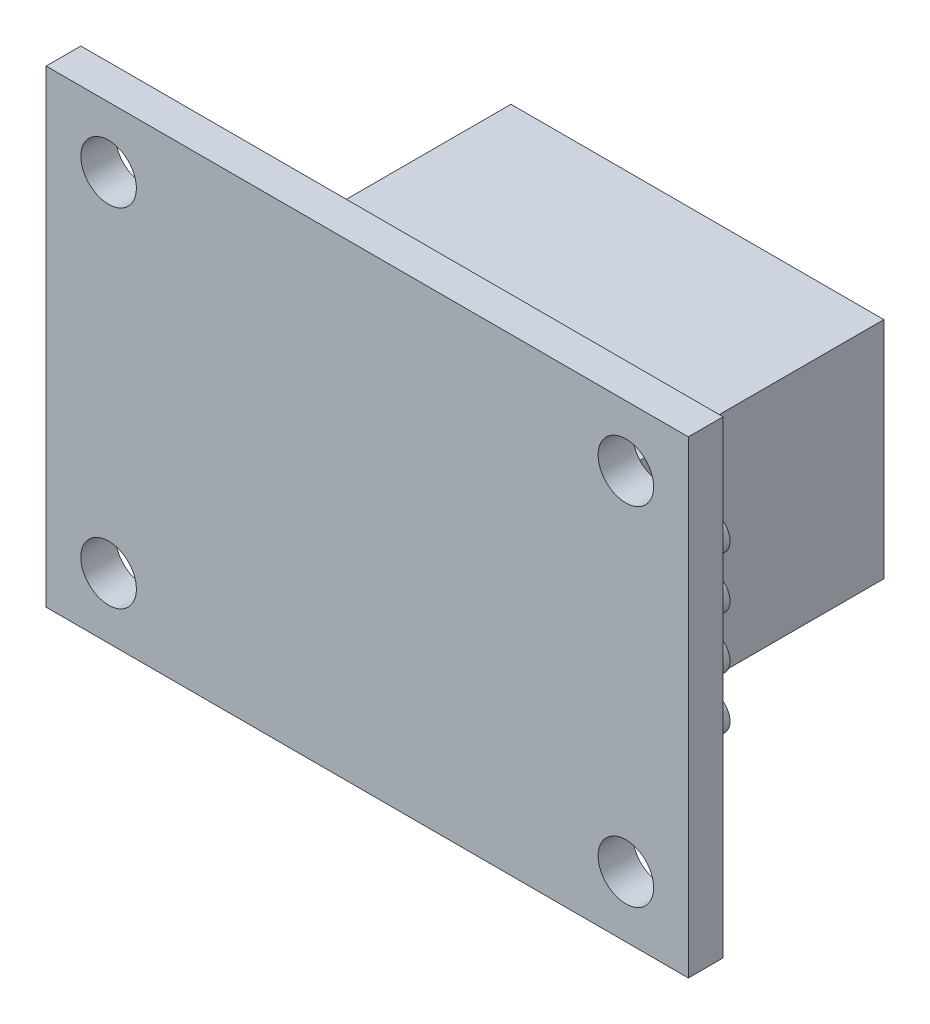
from build123d import *

# Parameters (mm, degrees)
SKETCH_1_W          = 37
SKETCH_1_H          = 27
EXTRUDE_1_DEPTH     = 2
SKETCH_2_R          = 1.6
CUT_EXTRUDE_1_DEPTH = 28.407139806
SKETCH_3_W          = 21.485092325
SKETCH_3_H          = 12.933183026
EXTRUDE_2_DEPTH     = 17
SKETCH_4_R          = 1
EXTRUDE_3_DEPTH     = 3


with BuildPart() as part:
    # 草圖1 → 填料-伸長1 (new body)
    with BuildSketch(Plane.XY):
        with Locations((-2.626304802, -3.844467641)):
            Rectangle(SKETCH_1_W, SKETCH_1_H)
    extrude(amount=EXTRUDE_1_DEPTH)

    # 草圖2 → 除料-伸長1 (cut, through all)
    with BuildSketch(Plane(origin=(0, 0, 0), x_dir=(-1, 0, 0), z_dir=(0, 0, -1))):
        with Locations((-12.273695198, 6.155532359)):
            Circle(SKETCH_2_R)
        with Locations((-12.273695198, -13.844467641)):
            Circle(SKETCH_2_R)
        with Locations((17.526304802, -13.844467641)):
            Circle(SKETCH_2_R)
        with Locations((17.526304802, 6.155532359)):
            Circle(SKETCH_2_R)
    extrude(amount=-CUT_EXTRUDE_1_DEPTH, mode=Mode.SUBTRACT)

    # 草圖3 → 填料-伸長2 (add)
    with BuildSketch(Plane(origin=(0, 0, 0), x_dir=(-1, 0, 0), z_dir=(0, 0, -1))):
        with Locations((2.605240986, -4.328935409)):
            Rectangle(SKETCH_3_W, SKETCH_3_H)
    extrude(amount=EXTRUDE_2_DEPTH)

    # 草圖4 → 填料-伸長3 (add)
    with BuildSketch(Plane(origin=(0, 0, 0), x_dir=(-1, 0, 0), z_dir=(0, 0, -1))):
        with Locations(Location((-12.273695198, -2.344467641, 0), (0, 0, 180))):
            Circle(SKETCH_4_R)
        with Locations(Location((-12.273695198, -5.344467641, 0), (0, 0, 180))):
            Circle(SKETCH_4_R)
        with Locations(Location((-12.273695198, -8.344467641, 0), (0, 0, 180))):
            Circle(SKETCH_4_R)
        with Locations(Location((-12.273695198, 0.655532359, 0), (0, 0, 180))):
            Circle(SKETCH_4_R)
    extrude(amount=EXTRUDE_3_DEPTH)


solid = part.part
